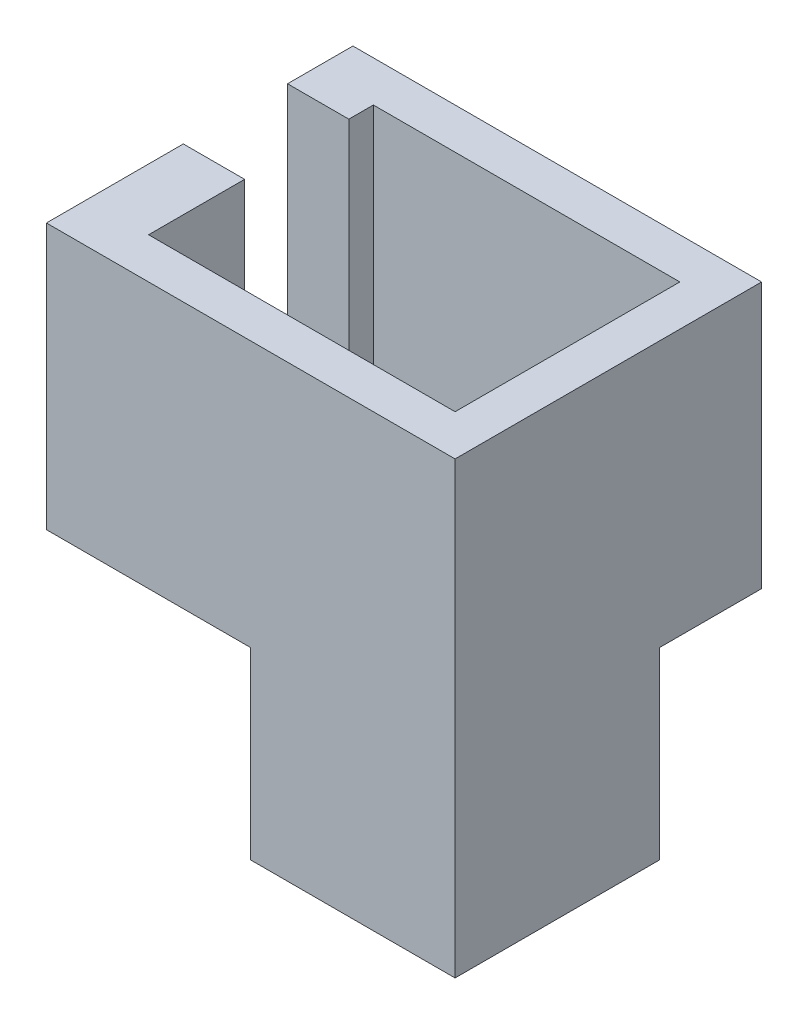
from build123d import *

# Parameters (mm, degrees)
BOSS_EXTRUDE1_DEPTH = 12
SKETCH3_W           = 20
SKETCH3_H           = 15
BOSS_EXTRUDE2_DEPTH = 1
SKETCH4_W           = 10
SKETCH4_H           = 10
BOSS_EXTRUDE3_DEPTH = 9
SKETCH5_R           = 2.5
BOSS_EXTRUDE7_DEPTH = 0.1


with BuildPart() as part:
    # Sketch1 → Boss-Extrude1 (new body)
    with BuildSketch(Plane(origin=(0, 0, 0), x_dir=(1, 0, 0), z_dir=(0, 1, 0))):
        Polygon((3, 2), (18, 2), (18, 13), (3, 13), (3, 11.8), (0, 11.8), (0, 15), (20, 15), (20, 0), (0, 0), (0, 6.7), (3, 6.7), align=None)
    extrude(amount=BOSS_EXTRUDE1_DEPTH)

    # Sketch3 → Boss-Extrude2 (add)
    with BuildSketch(Plane.XZ):
        with Locations((10, -7.5)):
            Rectangle(SKETCH3_W, SKETCH3_H)
    extrude(amount=BOSS_EXTRUDE2_DEPTH)

    # Sketch4 → Boss-Extrude3 (add)
    with BuildSketch(Plane.XZ.offset(1)):
        with Locations((15, -5)):
            Rectangle(SKETCH4_W, SKETCH4_H)
    extrude(amount=BOSS_EXTRUDE3_DEPTH)

    # Sketch5 → Boss-Extrude7 (add)
    with BuildSketch(Plane.ZY.offset(-18)):
        with Locations(Location((-10.49, 2.51, 0), (0, 0, 180))):
            Circle(SKETCH5_R)
    extrude(amount=BOSS_EXTRUDE7_DEPTH)


solid = part.part
